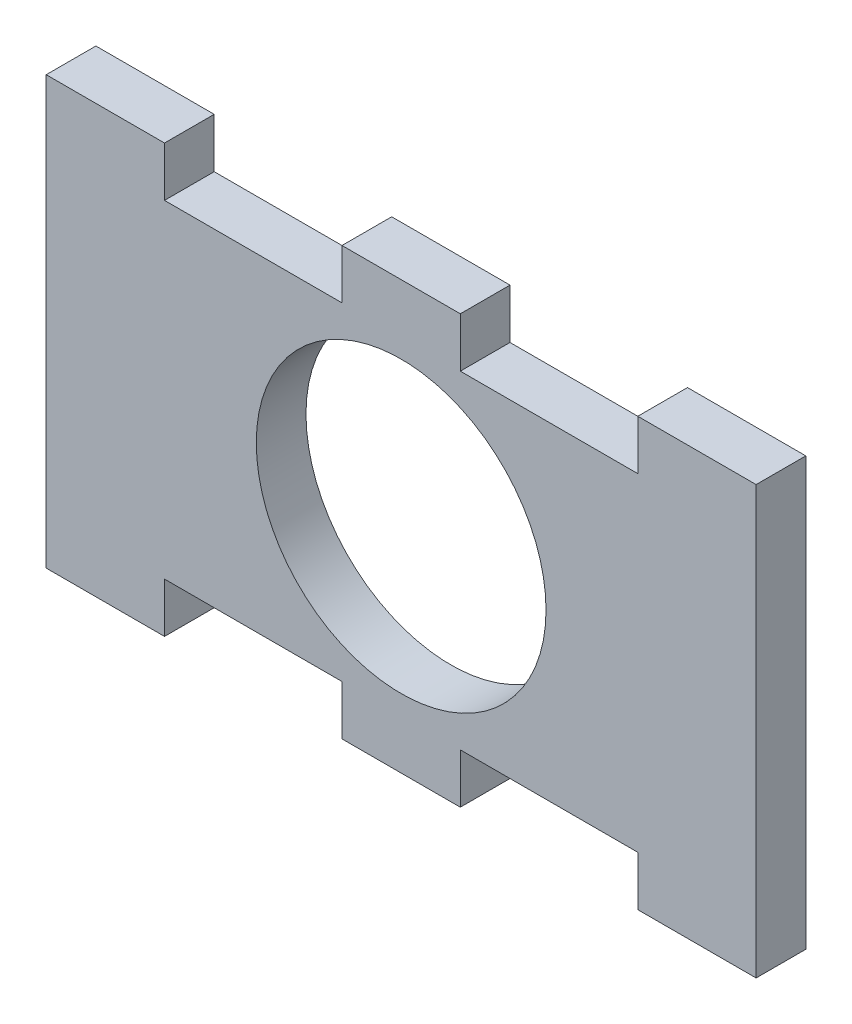
from build123d import *

# Parameters (mm, degrees)
SKETCH1_W           = 76.2
SKETCH1_H           = 35.2
BOSS_EXTRUDE1_DEPTH = 5.334
SKETCH2_R           = 15.55
CUT_EXTRUDE1_DEPTH  = 43.306282701
SKETCH3_W           = 12.7
SKETCH3_H           = 5.334
BOSS_EXTRUDE2_DEPTH = 5.334
SKETCH4_W           = 12.7
SKETCH4_H           = 5.334
BOSS_EXTRUDE3_DEPTH = 5.334


with BuildPart() as part:
    # Sketch1 → Boss-Extrude1 (new body)
    with BuildSketch(Plane.XY):
        Rectangle(SKETCH1_W, SKETCH1_H)
    extrude(amount=-BOSS_EXTRUDE1_DEPTH)

    # Sketch2 → Cut-Extrude1 (cut, through all)
    with BuildSketch(Plane.XY):
        Circle(SKETCH2_R)
    extrude(amount=-CUT_EXTRUDE1_DEPTH, mode=Mode.SUBTRACT)

    # Sketch3 → Boss-Extrude2 (add)
    with BuildSketch(Plane(origin=(0, 17.6, 0), x_dir=(1, 0, 0), z_dir=(0, 1, 0))):
        with Locations((-31.75, 2.667)):
            Rectangle(SKETCH3_W, SKETCH3_H)
        with Locations((0, 2.667)):
            Rectangle(SKETCH3_W, SKETCH3_H)
        with Locations((31.75, 2.667)):
            Rectangle(SKETCH3_W, SKETCH3_H)
    extrude(amount=BOSS_EXTRUDE2_DEPTH)

    # Sketch4 → Boss-Extrude3 (add)
    with BuildSketch(Plane.XZ.offset(17.6)):
        with Locations((-31.75, -2.667)):
            Rectangle(SKETCH4_W, SKETCH4_H)
        with Locations((0, -2.667)):
            Rectangle(SKETCH4_W, SKETCH4_H)
        with Locations((31.75, -2.667)):
            Rectangle(SKETCH4_W, SKETCH4_H)
    extrude(amount=BOSS_EXTRUDE3_DEPTH)


solid = part.part
